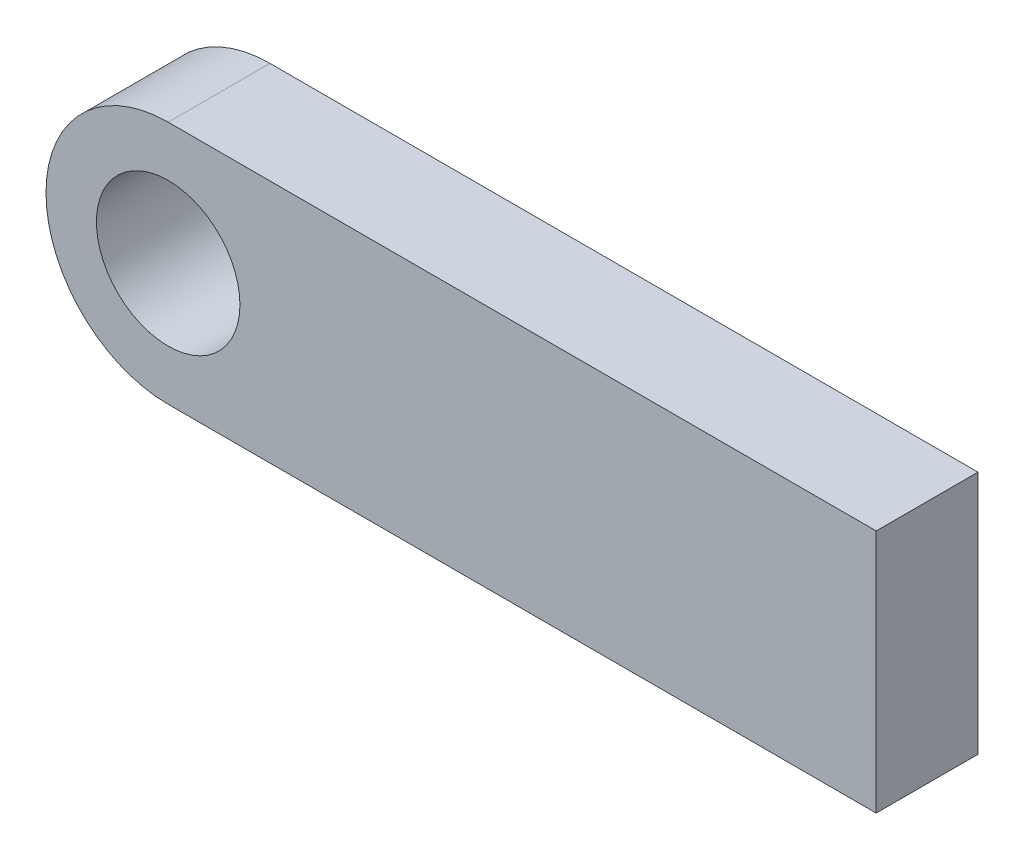
from build123d import *

# Parameters (mm, degrees)
SKETCH_1_R      = 3.524676545
EXTRUDE_1_DEPTH = 2.5


with BuildPart() as part:
    # 草图1 → 凸台-拉伸1 (new, symmetric)
    with BuildSketch(Plane.XY):
        with BuildLine():
            Line((0, 6), (34.770223243, 6))
            Line((34.770223243, 6), (34.770223243, -6))
            Line((34.770223243, -6), (0, -6))
            ThreePointArc((0, -6), (-6, 0), (0, 6))
        make_face()
        Circle(SKETCH_1_R, mode=Mode.SUBTRACT)
    extrude(amount=EXTRUDE_1_DEPTH, both=True)


solid = part.part
